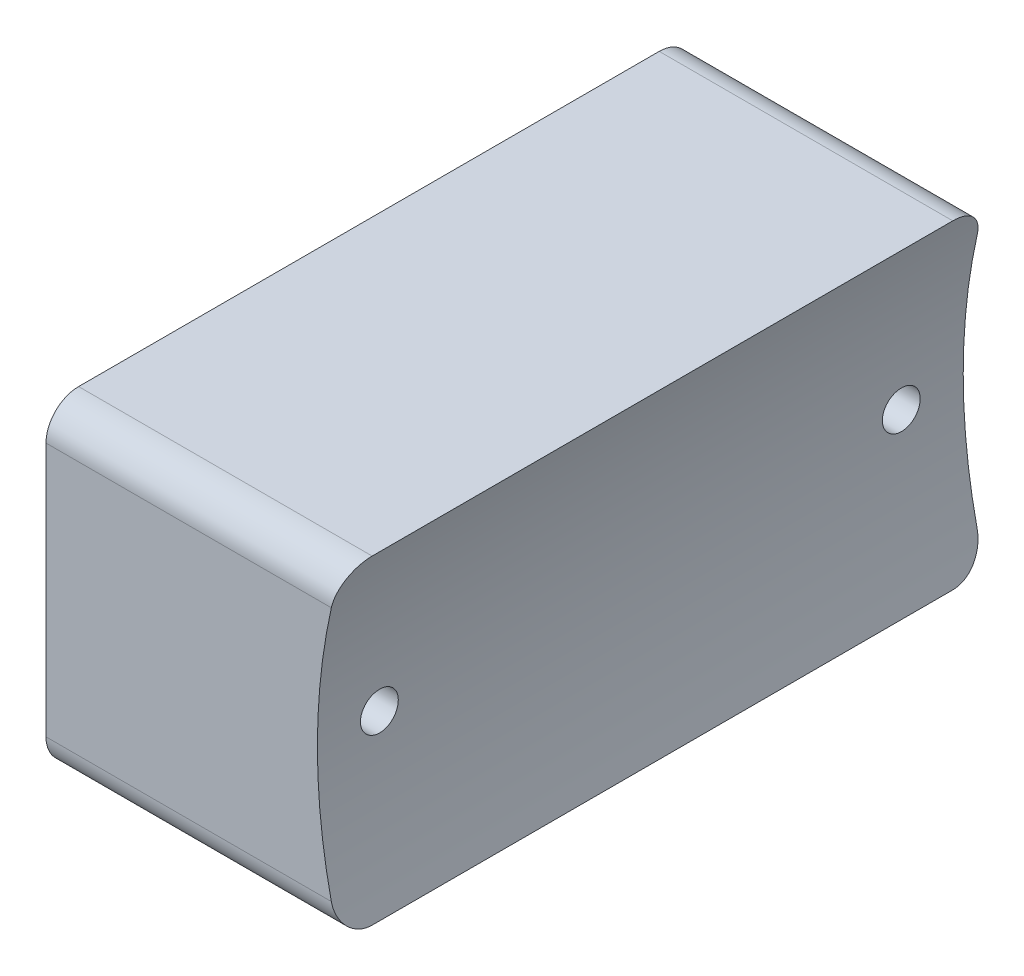
from build123d import *

# Parameters (mm, degrees)
SKETCH_1_W          = 49.5
SKETCH_1_H          = 24.5
EXTRUDE_1_DEPTH     = 22.5
SKETCH_2_R          = 2.5
CUT_EXTRUDE_1_DEPTH = 3
SKETCH_3_W          = 15.2
SKETCH_3_H          = 2.5
CUT_EXTRUDE_2_DEPTH = 8
CUT_EXTRUDE_3_DEPTH = 50
CUT_EXTRUDE_START   = 22.5
SKETCH_5_R          = 1.45
CUT_EXTRUDE_4_DEPTH = 10
FILLET_1_R          = 2.5


with BuildPart() as part:
    # Эскиз1 → Бобышка-Вытянуть1 (new body)
    with BuildSketch(Plane(origin=(0, 0, 0), x_dir=(0, 0, -1), z_dir=(1, 0, 0))):
        Rectangle(SKETCH_1_W, SKETCH_1_H)
    extrude(amount=EXTRUDE_1_DEPTH)

    # Эскиз2 → Вырез-Вытянуть1 (cut)
    with BuildSketch(Plane.ZY):
        with Locations((-20, -7.25)):
            Circle(SKETCH_2_R)
        with Locations((20, -7.25)):
            Circle(SKETCH_2_R)
    extrude(amount=-CUT_EXTRUDE_1_DEPTH, mode=Mode.SUBTRACT)

    # Эскиз3 → Вырез-Вытянуть2 (cut)
    with BuildSketch(Plane.ZY):
        with Locations((0, 8.75)):
            Rectangle(SKETCH_3_W, SKETCH_3_H)
    extrude(amount=-CUT_EXTRUDE_2_DEPTH, mode=Mode.SUBTRACT)

    # Эскиз4 → Вырез-Вытянуть3 (cut)
    with BuildSketch(Plane(origin=(0, 0, -24.75), x_dir=(-1, 0, 0), z_dir=(0, 0, -1))):
        with BuildLine():
            Line((-22.5, 12.25), (-22.5, -12.25))
            ThreePointArc((-22.5, -12.25), (-20.800548495, 0), (-22.5, 12.25))
        make_face()
    extrude(amount=-CUT_EXTRUDE_3_DEPTH, mode=Mode.SUBTRACT)

    # Эскиз5 → Вырез-Вытянуть4 (cut)
    with BuildSketch(Plane(origin=(0, 0, 0), x_dir=(0, 0, -1), z_dir=(1, 0, 0)).offset(CUT_EXTRUDE_START)):
        with Locations((-20, 0)):
            Circle(SKETCH_5_R)
        with Locations((20, 0)):
            Circle(SKETCH_5_R)
    extrude(amount=-CUT_EXTRUDE_4_DEPTH, mode=Mode.SUBTRACT)

    # Скругление1
    fillet_1_edges = [part.edges().sort_by_distance(p)[0] for p in [
        (11.25, 12.25, -24.75),
        (11.25, -12.25, -24.75),
        (11.25, -12.25, 24.75),
        (11.25, 12.25, 24.75),
    ]]
    fillet(fillet_1_edges, radius=FILLET_1_R)


solid = part.part
